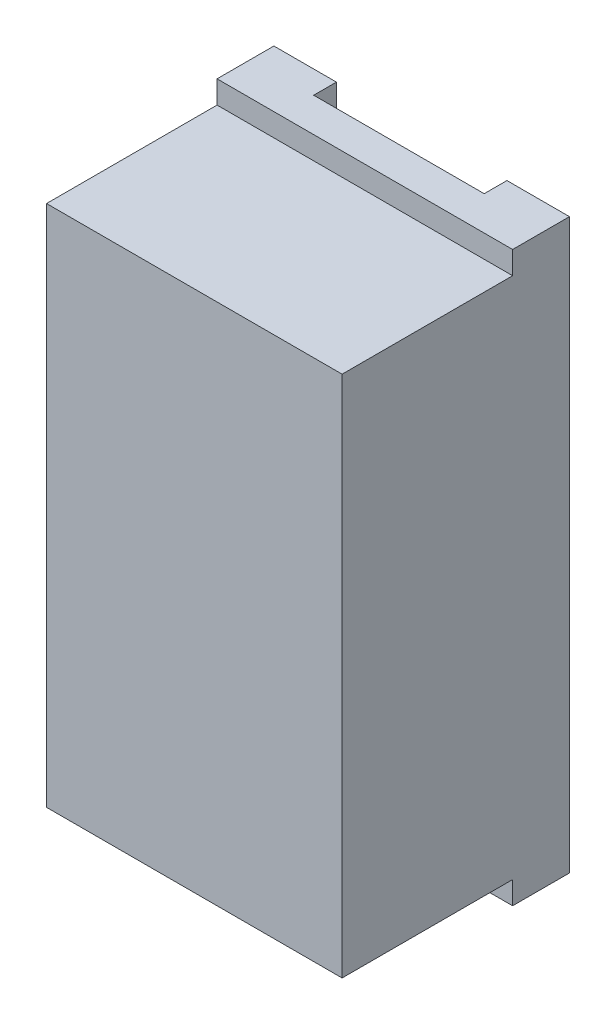
from build123d import *

# Parameters (mm, degrees)
EXTRUDE_1_DEPTH     = 13
SKETCH_4_W          = 20
SKETCH_4_H          = 60
CUT_EXTRUDE_1_DEPTH = 7.5


with BuildPart() as part:
    # 스케치2 → 보스-돌출1 (new, symmetric)
    with BuildSketch(Plane(origin=(0, 0, 0), x_dir=(0, 0, -1), z_dir=(1, 0, 0))):
        Polygon((0, 0), (15, 0), (15, 2), (20, 2), (20, -48), (15, -48), (15, -46), (0, -46), align=None)
    extrude(amount=EXTRUDE_1_DEPTH, both=True)

    # 스케치4 → 컷-돌출1 (cut, symmetric)
    with BuildSketch(Plane(origin=(0, 0, 0), x_dir=(0, 0, -1), z_dir=(1, 0, 0))):
        with Locations((28, -23.786029553)):
            Rectangle(SKETCH_4_W, SKETCH_4_H)
    extrude(amount=CUT_EXTRUDE_1_DEPTH, both=True, mode=Mode.SUBTRACT)


solid = part.part
